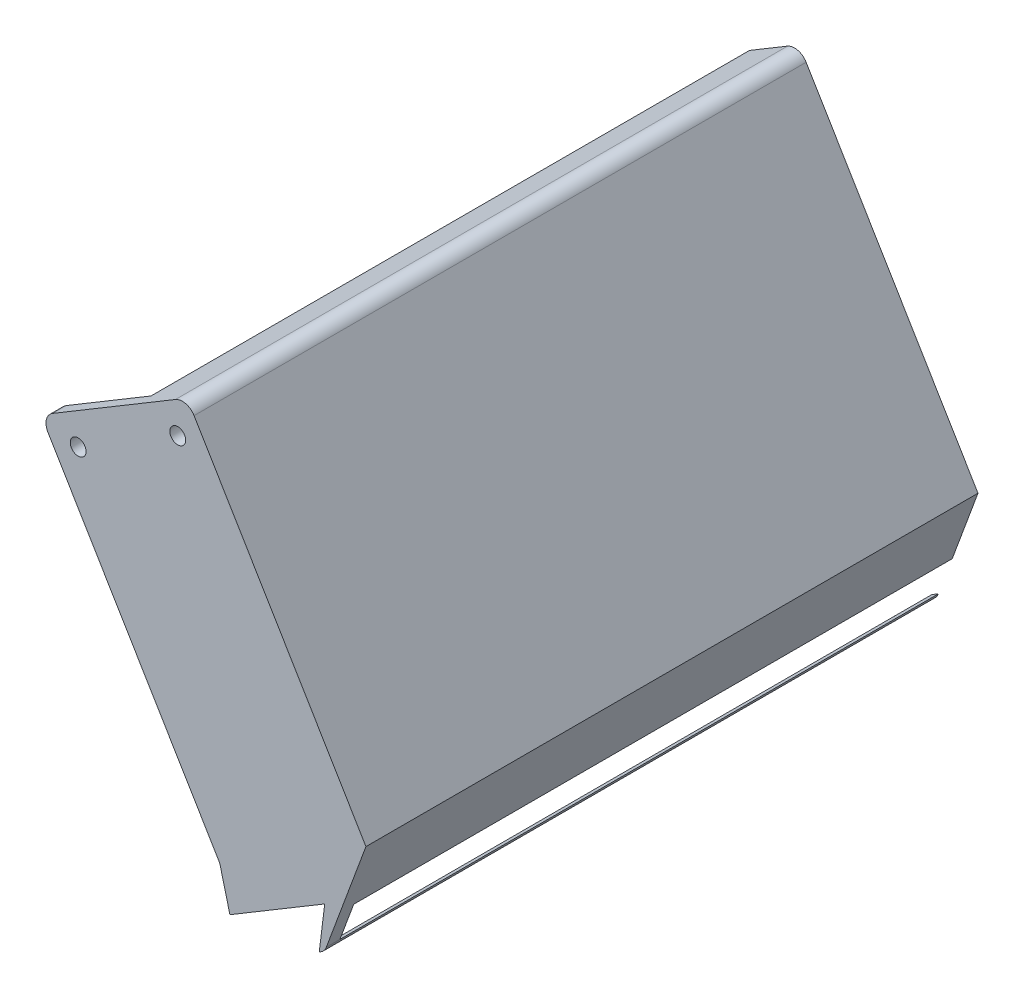
from build123d import *

# Parameters (mm, degrees)
SKETCH_1_R          = 1.75
EXTRUDE_1_DEPTH     = 135.293792798
SKETCH_3_W          = 133.999999999
SKETCH_3_H          = 92.793140679
CUT_EXTRUDE_1_DEPTH = 210.099404157


with BuildPart() as part:
    # 草图1 → 凸台-拉伸1 (new body)
    with BuildSketch(Plane.XY):
        with BuildLine():
            Line((-17.129972102, 49.08105856), (-8.373318144, 72.720547785))
            Line((-8.373318144, 72.720547785), (-46.360961782, 136.227129066))
            ThreePointArc((-46.360961782, 136.227129066), (-48.203989789, 137.596554385), (-50.47553732, 137.261666712))
            Line((-50.47553732, 137.261666712), (-77.638405872, 121.013691307))
            ThreePointArc((-77.638405872, 121.013691307), (-79.007831191, 119.1706633), (-78.672943518, 116.899115769))
            Line((-78.672943518, 116.899115769), (-40.908434768, 53.765564573))
            ThreePointArc((-40.908434768, 53.765564573), (-40.714211977, 53.380474511), (-40.57721581, 52.971513757))
            Line((-40.57721581, 52.971513757), (-38.440433205, 44.648087586))
            Line((-38.440433205, 44.648087586), (-17.486445488, 57.181732929))
            Line((-17.486445488, 57.181732929), (-18.690847722, 47.397023253))
            ThreePointArc((-18.690847722, 47.397023253), (-17.742918238, 48.083798514), (-17.129972102, 49.08105856))
        make_face()
        with Locations(Location((-71.983811388, 117.404597068, 0), (0, 0, 90))):
            Circle(SKETCH_1_R, mode=Mode.SUBTRACT)
        with Locations(Location((-49.970056021, 130.572534582, 0), (0, 0, 90))):
            Circle(SKETCH_1_R, mode=Mode.SUBTRACT)
    extrude(amount=EXTRUDE_1_DEPTH)

    # 草图3 → 切除-拉伸1 (cut, through all)
    with BuildSketch(Plane(origin=(14.886439913, 8.904336531, 0), x_dir=(0, 0, -1), z_dir=(0.8581922502722595, 0.5133284149281387, 0))):
        with Locations((-65.293792798, 97.310855858)):
            Rectangle(SKETCH_3_W, SKETCH_3_H)
    extrude(amount=-CUT_EXTRUDE_1_DEPTH, mode=Mode.SUBTRACT)


solid = part.part
